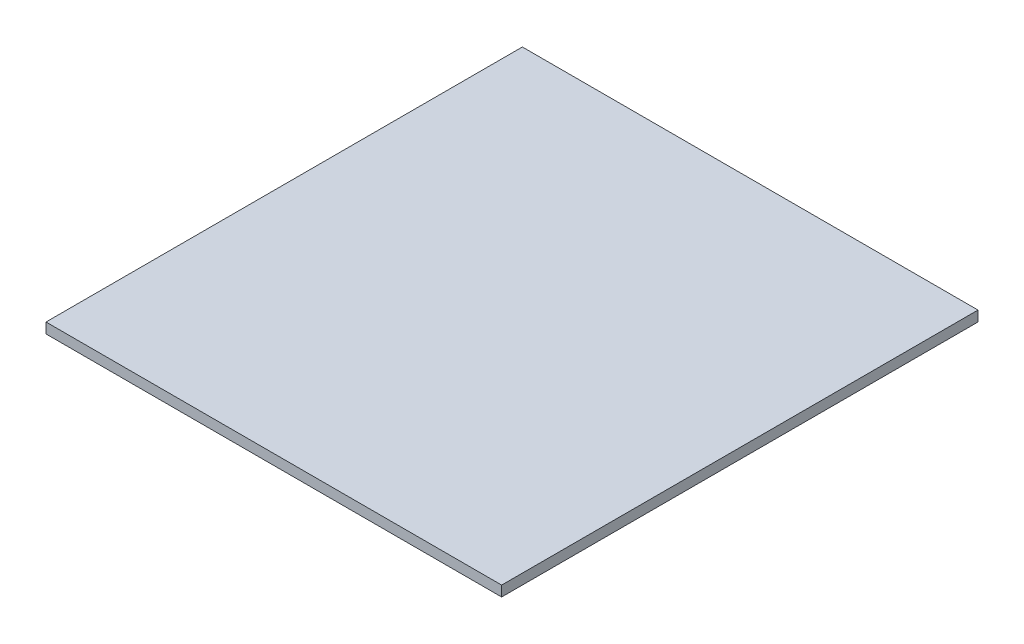
from build123d import *

# Parameters (mm, degrees)
SKETCH1_W           = 279.4
SKETCH1_H           = 292.1
BOSS_EXTRUDE1_DEPTH = 6.35


with BuildPart() as part:
    # Sketch1 → Boss-Extrude1 (new body)
    with BuildSketch(Plane(origin=(0, 0, 0), x_dir=(1, 0, 0), z_dir=(0, 1, 0))):
        with Locations((139.7, 146.05)):
            Rectangle(SKETCH1_W, SKETCH1_H)
    extrude(amount=BOSS_EXTRUDE1_DEPTH)


solid = part.part
